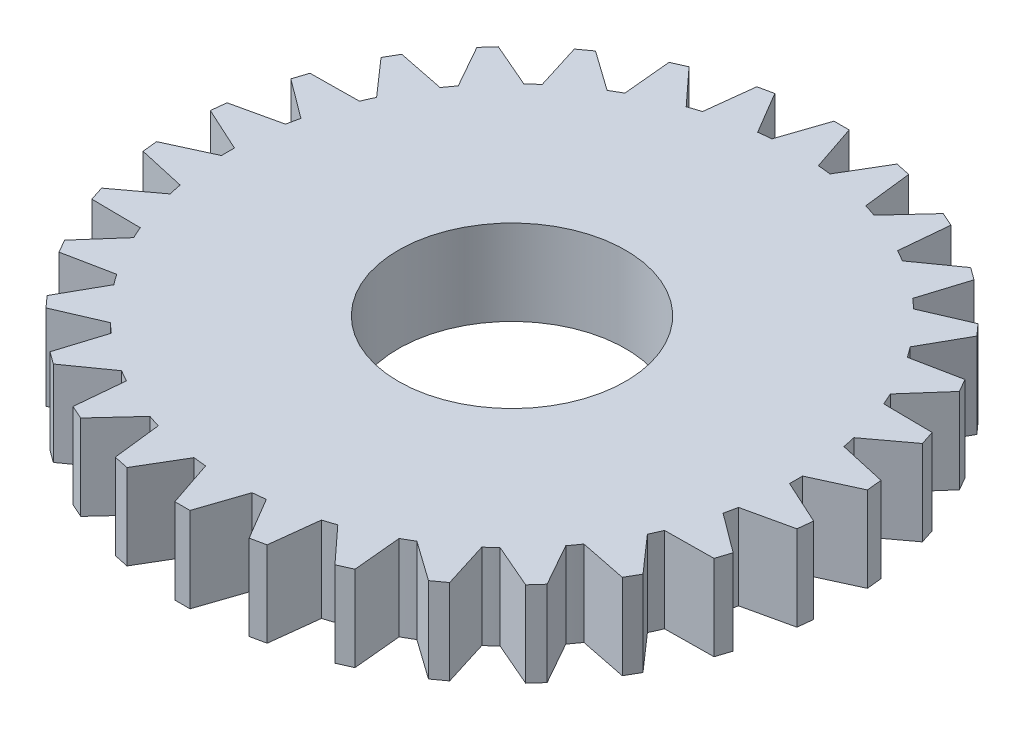
from build123d import *

# Parameters (mm, degrees)
BOSS_EXTRUDE1_DEPTH = 1.5
SKETCH2_R           = 2
CUT_EXTRUDE1_DEPTH  = 9.326084366


with BuildPart() as part:
    # Sketch1 → Boss-Extrude1 (new body)
    with BuildSketch(Plane(origin=(0, 0, 0), x_dir=(1, 0, 0), z_dir=(0, 1, 0))):
        with BuildLine():
            Line((-0.133547548, 5.8), (0.133547548, 5.8))
            Line((0.133547548, 5.8), (0.408993174, 4.983244383))
            ThreePointArc((0.408993174, 4.983244383), (0.522642316, 4.972609477), (0.636019074, 4.959383))
            Line((0.636019074, 4.959383), (1.075258593, 5.701022181))
            Line((1.075258593, 5.701022181), (1.33651702, 5.645489988))
            Line((1.33651702, 5.645489988), (1.436130457, 4.789314075))
            ThreePointArc((1.436130457, 4.789314075), (1.545084972, 4.755282581), (1.653234236, 4.718772781))
            Line((1.653234236, 4.718772781), (2.237070774, 5.352882336))
            Line((2.237070774, 5.352882336), (2.481074286, 5.244244973))
            Line((2.481074286, 5.244244973), (2.400501948, 4.38606776))
            ThreePointArc((2.400501948, 4.38606776), (2.5, 4.330127019), (2.598195129, 4.271929549))
            Line((2.598195129, 4.271929549), (3.301112228, 4.770795846))
            Line((3.301112228, 4.770795846), (3.517196699, 4.613801288))
            Line((3.517196699, 4.613801288), (3.259959985, 3.791129237))
            ThreePointArc((3.259959985, 3.791129237), (3.345653032, 3.715724127), (3.429602427, 3.638382497))
            Line((3.429602427, 3.638382497), (4.220879236, 3.980202686))
            Line((4.220879236, 3.980202686), (4.399600739, 3.781712348))
            Line((4.399600739, 3.781712348), (3.976942128, 3.030500175))
            ThreePointArc((3.976942128, 3.030500175), (4.045084972, 2.938926261), (4.111119642, 2.84582067))
            Line((4.111119642, 2.84582067), (4.956173568, 3.015655569))
            Line((4.956173568, 3.015655569), (5.089721116, 2.784344431))
            Line((5.089721116, 2.784344431), (4.520112816, 2.137423713))
            ThreePointArc((4.520112816, 2.137423713), (4.567727288, 2.033683215), (4.612961202, 1.928882825))
            Line((4.612961202, 1.928882825), (5.474859333, 1.919309833))
            Line((5.474859333, 1.919309833), (5.557396256, 1.665287302))
            Line((5.557396256, 1.665287302), (4.865732884, 1.150931578))
            ThreePointArc((4.865732884, 1.150931578), (4.890738004, 1.039558454), (4.913194221, 0.927643544))
            Line((4.913194221, 0.927643544), (5.754267473, 0.739081047))
            Line((5.754267473, 0.739081047), (5.782186513, 0.473449127))
            Line((5.782186513, 0.473449127), (4.998697077, 0.114138211))
            ThreePointArc((4.998697077, 0.114138211), (5, 0), (4.998697077, -0.114138211))
            Line((4.998697077, -0.114138211), (5.782186513, -0.473449127))
            Line((5.782186513, -0.473449127), (5.754267473, -0.739081047))
            Line((5.754267473, -0.739081047), (4.913194221, -0.927643544))
            ThreePointArc((4.913194221, -0.927643544), (4.890738004, -1.039558454), (4.865732884, -1.150931578))
            Line((4.865732884, -1.150931578), (5.557396256, -1.665287302))
            Line((5.557396256, -1.665287302), (5.474859333, -1.919309833))
            Line((5.474859333, -1.919309833), (4.612961202, -1.928882825))
            ThreePointArc((4.612961202, -1.928882825), (4.567727288, -2.033683215), (4.520112816, -2.137423713))
            Line((4.520112816, -2.137423713), (5.089721116, -2.784344431))
            Line((5.089721116, -2.784344431), (4.956173568, -3.015655569))
            Line((4.956173568, -3.015655569), (4.111119642, -2.84582067))
            ThreePointArc((4.111119642, -2.84582067), (4.045084972, -2.938926261), (3.976942128, -3.030500175))
            Line((3.976942128, -3.030500175), (4.399600739, -3.781712348))
            Line((4.399600739, -3.781712348), (4.220879236, -3.980202686))
            Line((4.220879236, -3.980202686), (3.429602427, -3.638382497))
            ThreePointArc((3.429602427, -3.638382497), (3.345653032, -3.715724127), (3.259959985, -3.791129237))
            Line((3.259959985, -3.791129237), (3.517196699, -4.613801288))
            Line((3.517196699, -4.613801288), (3.301112228, -4.770795846))
            Line((3.301112228, -4.770795846), (2.598195129, -4.271929549))
            ThreePointArc((2.598195129, -4.271929549), (2.5, -4.330127019), (2.400501948, -4.38606776))
            Line((2.400501948, -4.38606776), (2.481074286, -5.244244973))
            Line((2.481074286, -5.244244973), (2.237070774, -5.352882336))
            Line((2.237070774, -5.352882336), (1.653234236, -4.718772781))
            ThreePointArc((1.653234236, -4.718772781), (1.545084972, -4.755282581), (1.436130457, -4.789314075))
            Line((1.436130457, -4.789314075), (1.33651702, -5.645489988))
            Line((1.33651702, -5.645489988), (1.075258593, -5.701022181))
            Line((1.075258593, -5.701022181), (0.636019074, -4.959383))
            ThreePointArc((0.636019074, -4.959383), (0.522642316, -4.972609477), (0.408993174, -4.983244383))
            Line((0.408993174, -4.983244383), (0.133547548, -5.8))
            Line((0.133547548, -5.8), (-0.133547548, -5.8))
            Line((-0.133547548, -5.8), (-0.408993174, -4.983244383))
            ThreePointArc((-0.408993174, -4.983244383), (-0.522642316, -4.972609477), (-0.636019074, -4.959383))
            Line((-0.636019074, -4.959383), (-1.075258593, -5.701022181))
            Line((-1.075258593, -5.701022181), (-1.33651702, -5.645489988))
            Line((-1.33651702, -5.645489988), (-1.436130457, -4.789314075))
            ThreePointArc((-1.436130457, -4.789314075), (-1.545084972, -4.755282581), (-1.653234236, -4.718772781))
            Line((-1.653234236, -4.718772781), (-2.237070774, -5.352882336))
            Line((-2.237070774, -5.352882336), (-2.481074286, -5.244244973))
            Line((-2.481074286, -5.244244973), (-2.400501948, -4.38606776))
            ThreePointArc((-2.400501948, -4.38606776), (-2.5, -4.330127019), (-2.598195129, -4.271929549))
            Line((-2.598195129, -4.271929549), (-3.301112228, -4.770795846))
            Line((-3.301112228, -4.770795846), (-3.517196699, -4.613801288))
            Line((-3.517196699, -4.613801288), (-3.259959985, -3.791129237))
            ThreePointArc((-3.259959985, -3.791129237), (-3.345653032, -3.715724127), (-3.429602427, -3.638382497))
            Line((-3.429602427, -3.638382497), (-4.220879236, -3.980202686))
            Line((-4.220879236, -3.980202686), (-4.399600739, -3.781712348))
            Line((-4.399600739, -3.781712348), (-3.976942128, -3.030500175))
            ThreePointArc((-3.976942128, -3.030500175), (-4.045084972, -2.938926261), (-4.111119642, -2.84582067))
            Line((-4.111119642, -2.84582067), (-4.956173568, -3.015655569))
            Line((-4.956173568, -3.015655569), (-5.089721116, -2.784344431))
            Line((-5.089721116, -2.784344431), (-4.520112816, -2.137423713))
            ThreePointArc((-4.520112816, -2.137423713), (-4.567727288, -2.033683215), (-4.612961202, -1.928882825))
            Line((-4.612961202, -1.928882825), (-5.474859333, -1.919309833))
            Line((-5.474859333, -1.919309833), (-5.557396256, -1.665287302))
            Line((-5.557396256, -1.665287302), (-4.865732884, -1.150931578))
            ThreePointArc((-4.865732884, -1.150931578), (-4.890738004, -1.039558454), (-4.913194221, -0.927643544))
            Line((-4.913194221, -0.927643544), (-5.754267473, -0.739081047))
            Line((-5.754267473, -0.739081047), (-5.782186513, -0.473449127))
            Line((-5.782186513, -0.473449127), (-4.998697077, -0.114138211))
            ThreePointArc((-4.998697077, -0.114138211), (-5, 0), (-4.998697077, 0.114138211))
            Line((-4.998697077, 0.114138211), (-5.782186513, 0.473449127))
            Line((-5.782186513, 0.473449127), (-5.754267473, 0.739081047))
            Line((-5.754267473, 0.739081047), (-4.913194221, 0.927643544))
            ThreePointArc((-4.913194221, 0.927643544), (-4.890738004, 1.039558454), (-4.865732884, 1.150931578))
            Line((-4.865732884, 1.150931578), (-5.557396256, 1.665287302))
            Line((-5.557396256, 1.665287302), (-5.474859333, 1.919309833))
            Line((-5.474859333, 1.919309833), (-4.612961202, 1.928882825))
            ThreePointArc((-4.612961202, 1.928882825), (-4.567727288, 2.033683215), (-4.520112816, 2.137423713))
            Line((-4.520112816, 2.137423713), (-5.089721116, 2.784344431))
            Line((-5.089721116, 2.784344431), (-4.956173568, 3.015655569))
            Line((-4.956173568, 3.015655569), (-4.111119642, 2.84582067))
            ThreePointArc((-4.111119642, 2.84582067), (-4.045084972, 2.938926261), (-3.976942128, 3.030500175))
            Line((-3.976942128, 3.030500175), (-4.399600739, 3.781712348))
            Line((-4.399600739, 3.781712348), (-4.220879236, 3.980202686))
            Line((-4.220879236, 3.980202686), (-3.429602427, 3.638382497))
            ThreePointArc((-3.429602427, 3.638382497), (-3.345653032, 3.715724127), (-3.259959985, 3.791129237))
            Line((-3.259959985, 3.791129237), (-3.517196699, 4.613801288))
            Line((-3.517196699, 4.613801288), (-3.301112228, 4.770795846))
            Line((-3.301112228, 4.770795846), (-2.598195129, 4.271929549))
            ThreePointArc((-2.598195129, 4.271929549), (-2.5, 4.330127019), (-2.400501948, 4.38606776))
            Line((-2.400501948, 4.38606776), (-2.481074286, 5.244244973))
            Line((-2.481074286, 5.244244973), (-2.237070774, 5.352882336))
            Line((-2.237070774, 5.352882336), (-1.653234236, 4.718772781))
            ThreePointArc((-1.653234236, 4.718772781), (-1.545084972, 4.755282581), (-1.436130457, 4.789314075))
            Line((-1.436130457, 4.789314075), (-1.33651702, 5.645489988))
            Line((-1.33651702, 5.645489988), (-1.075258593, 5.701022181))
            Line((-1.075258593, 5.701022181), (-0.636019074, 4.959383))
            ThreePointArc((-0.636019074, 4.959383), (-0.522642316, 4.972609477), (-0.408993174, 4.983244383))
            Line((-0.408993174, 4.983244383), (-0.133547548, 5.8))
        make_face()
    extrude(amount=BOSS_EXTRUDE1_DEPTH)

    # Sketch2 → Cut-Extrude1 (cut, through all)
    with BuildSketch(Plane(origin=(0, 1.5, 0), x_dir=(1, 0, 0), z_dir=(0, 1, 0))):
        with Locations(Location((0, 0, 0), (0, 0, 270))):
            Circle(SKETCH2_R)
    extrude(amount=-CUT_EXTRUDE1_DEPTH, mode=Mode.SUBTRACT)


solid = part.part
